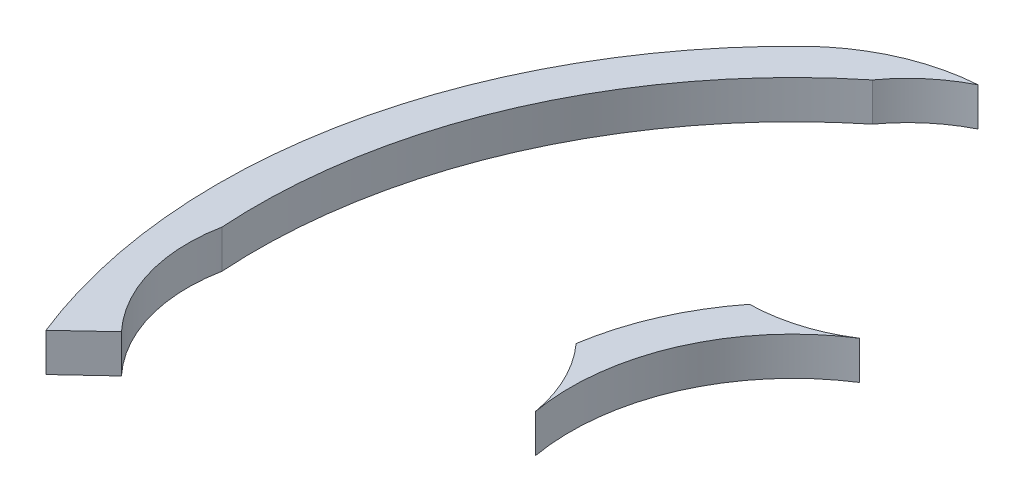
from build123d import *

# Parameters (mm, degrees)
BOSS_EXTRU_1_DEPTH   = 5
BOSS_EXTRU_1_2_DEPTH = 5


with BuildPart() as part:
    # Esquisse1 → Boss.-Extru.1 (new body)
    with BuildSketch(Plane(origin=(0, 0, 0), x_dir=(1, 0, 0), z_dir=(0, 1, 0))):
        with BuildLine():
            ThreePointArc((-68.670306383, 42.279177512), (-89.686909751, 4.154853404), (-85.986425434, -39.22103992))
            Line((-85.986425434, -39.22103992), (-80.900990435, -34.464540644))
            ThreePointArc((-80.900990435, -34.464540644), (-85.751719928, -25.903787737), (-86.17049139, -16.073187685))
            ThreePointArc((-86.17049139, -16.073187685), (-80.46737567, 16.597955279), (-60.365768188, 42.977009243))
            ThreePointArc((-60.365768188, 42.977009243), (-57.02057343, 46.585824911), (-52.927414878, 49.317112442))
            ThreePointArc((-52.927414878, 49.317112442), (-61.424892912, 47.198493002), (-68.670306383, 42.279177512))
        make_face()
    extrude(amount=BOSS_EXTRU_1_DEPTH)


with BuildPart() as body_2:
    # Esquisse1 → Boss.-Extru.1 2 (new body)
    with BuildSketch(Plane(origin=(0, 0, 0), x_dir=(1, 0, 0), z_dir=(0, 1, 0))):
        with BuildLine():
            ThreePointArc((-43.033244173, 9.606842383), (-47.479614127, 2.182422394), (-49.907579974, -6.124032915))
            ThreePointArc((-49.907579974, -6.124032915), (-46.673295144, -10.946787783), (-44.883425416, -16.470910269))
            ThreePointArc((-44.883425416, -16.470910269), (-42.897980579, 0.180265048), (-32.027211689, 12.948585782))
            ThreePointArc((-32.027211689, 12.948585782), (-37.296975691, 10.509497789), (-43.033244173, 9.606842383))
        make_face()
    extrude(amount=BOSS_EXTRU_1_2_DEPTH)


solid = Compound([part.part, body_2.part])
